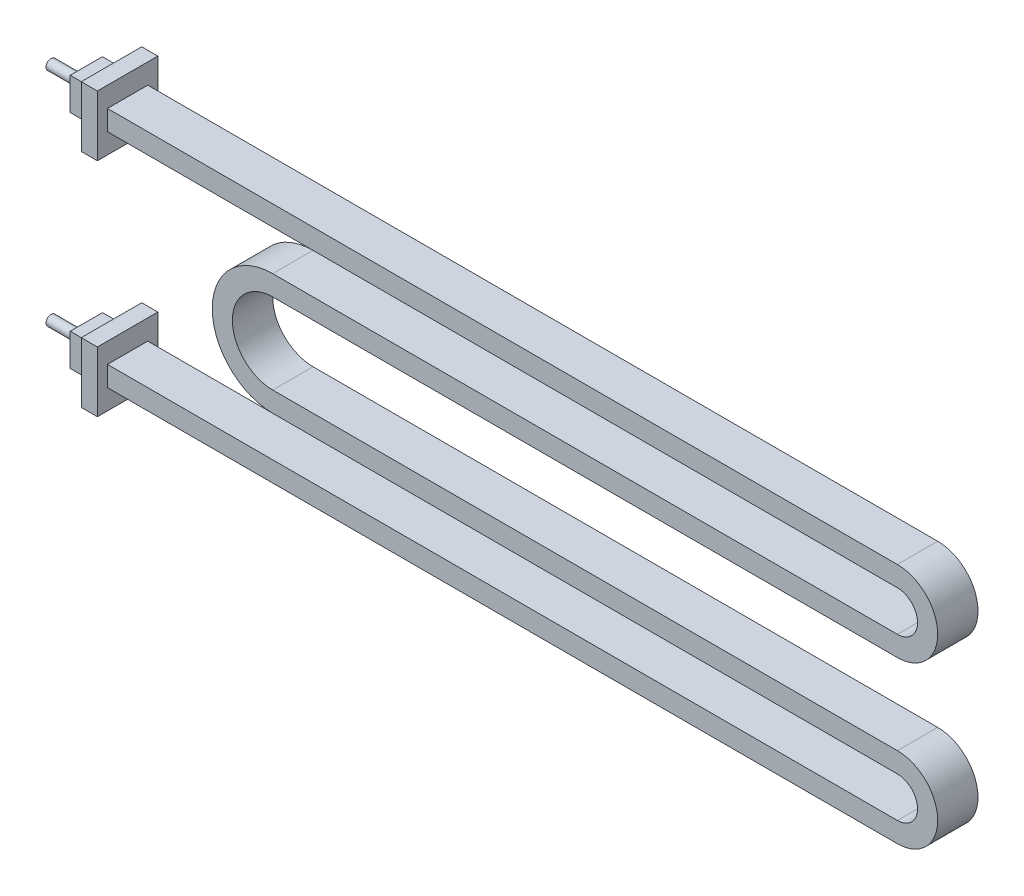
from build123d import *

# Parameters (mm, degrees)
BOSS_EXTRUDE1_DEPTH   = 10
SKETCH2_R             = 1.25
BOSS_EXTRUDE2_DEPTH   = 15
SKETCH3_R             = 1.25
BOSS_EXTRUDE3_DEPTH   = 15
SKETCH4_W             = 15
SKETCH4_H             = 15
BOSS_EXTRUDE5_DEPTH   = 4
BOSS_EXTRUDE5_2_DEPTH = 4
SKETCH5_W             = 8
SKETCH5_H             = 8
BOSS_EXTRUDE6_DEPTH   = 6.25
BOSS_EXTRUDE6_2_DEPTH = 6.25


with BuildPart() as part:
    # Sketch1 → Boss-Extrude1 (new body)
    with BuildSketch(Plane.XY):
        with BuildLine():
            Line((0, 0), (200, 0))
            ThreePointArc((200, 0), (210, -10), (200, -20))
            Line((200, -20), (45, -20))
            ThreePointArc((45, -20), (35, -30), (45, -40))
            Line((45, -40), (200, -40))
            ThreePointArc((200, -40), (210, -50), (200, -60))
            Line((200, -60), (0, -60))
            Line((0, -60), (0, -55))
            Line((0, -55), (200, -55))
            ThreePointArc((200, -55), (205, -50), (200, -45))
            Line((200, -45), (45, -45))
            ThreePointArc((45, -45), (30, -30), (45, -15))
            Line((45, -15), (200, -15))
            ThreePointArc((200, -15), (205, -10), (200, -5))
            Line((200, -5), (0, -5))
            Line((0, -5), (0, 0))
        make_face()
    extrude(amount=BOSS_EXTRUDE1_DEPTH)

    # Sketch2 → Boss-Extrude2 (add)
    with BuildSketch(Plane.ZY):
        with Locations(Location((5, -2.5, 0), (0, 0, 180))):
            Circle(SKETCH2_R)
    extrude(amount=BOSS_EXTRUDE2_DEPTH)

    # Sketch3 → Boss-Extrude3 (add)
    with BuildSketch(Plane.ZY):
        with Locations(Location((5, -57.5, 0), (0, 0, 180))):
            Circle(SKETCH3_R)
    extrude(amount=BOSS_EXTRUDE3_DEPTH)


with BuildPart() as body_2:
    # Sketch4 → Boss-Extrude5 (new body)
    with BuildSketch(Plane(origin=(0, 0, 0), x_dir=(0, 0, -1), z_dir=(1, 0, 0))):
        with Locations((-5, -57.5)):
            Rectangle(SKETCH4_W, SKETCH4_H)
    extrude(amount=BOSS_EXTRUDE5_DEPTH)


with BuildPart() as body_3:
    # Sketch4 → Boss-Extrude5 2 (new body)
    with BuildSketch(Plane(origin=(0, 0, 0), x_dir=(0, 0, -1), z_dir=(1, 0, 0))):
        with Locations((-5, -2.5)):
            Rectangle(SKETCH4_W, SKETCH4_H)
    extrude(amount=BOSS_EXTRUDE5_2_DEPTH)


with BuildPart() as body_4:
    # Sketch5 → Boss-Extrude6 (new body)
    with BuildSketch(Plane.ZY):
        with Locations((5, -57.5)):
            Rectangle(SKETCH5_W, SKETCH5_H)
    extrude(amount=BOSS_EXTRUDE6_DEPTH)


with BuildPart() as body_5:
    # Sketch5 → Boss-Extrude6 2 (new body)
    with BuildSketch(Plane.ZY):
        with Locations((5, -2.5)):
            Rectangle(SKETCH5_W, SKETCH5_H)
    extrude(amount=BOSS_EXTRUDE6_2_DEPTH)


solid = Compound([part.part, body_2.part, body_3.part, body_4.part, body_5.part])
